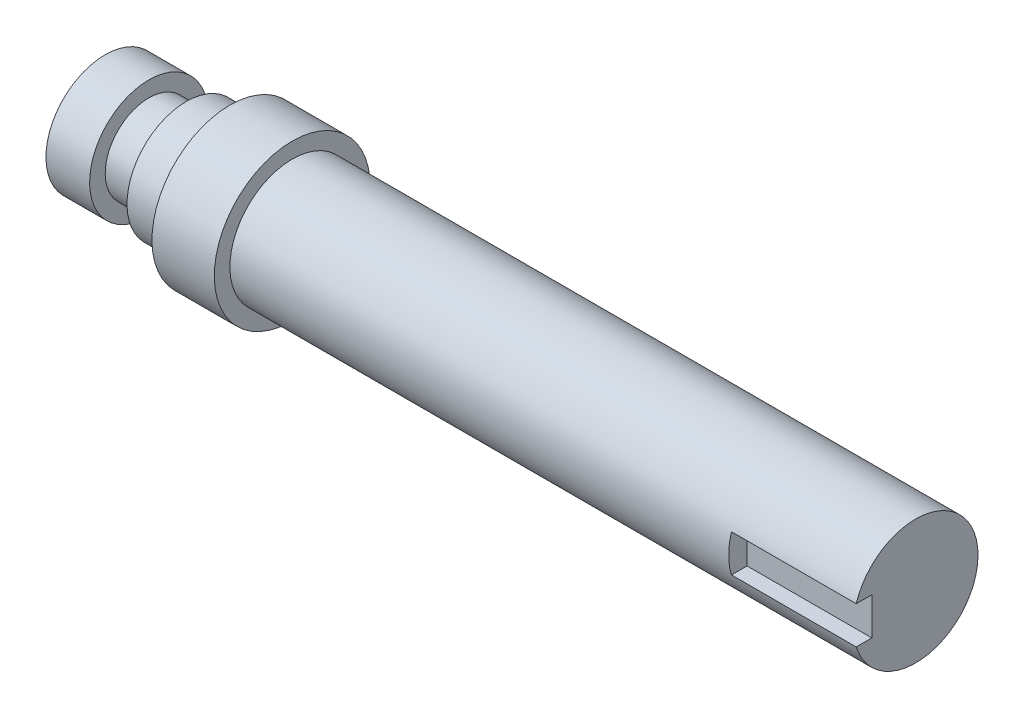
from build123d import *

# Parameters (mm, degrees)
CUT_EXTRUDE1_DEPTH = 20


with BuildPart() as part:
    # Sketch1 → Revolve1 (revolve)
    with BuildSketch(Plane.XY):
        Polygon((0, 0), (0, 9.5), (7, 9.5), (7, 7), (13, 7), (13, 9.5), (20, 9.5), (20, 12.5), (30, 12.5), (30, 10), (130, 10), (130, 0), align=None)
    revolve(axis=Axis((130, 0, 0), (-1, 0, 0)))

    # Sketch2 → Cut-Extrude1 (cut)
    with BuildSketch(Plane(origin=(130, 0, 0), x_dir=(0, 0, -1), z_dir=(1, 0, 0))):
        with BuildLine():
            Line((-9.539392014, 3), (-7.039392014, 3))
            Line((-7.039392014, 3), (-7.039392014, -3))
            Line((-7.039392014, -3), (-9.539392014, -3))
            ThreePointArc((-9.539392014, -3), (-10, 0), (-9.539392014, 3))
        make_face()
    extrude(amount=-CUT_EXTRUDE1_DEPTH, mode=Mode.SUBTRACT)


solid = part.part
